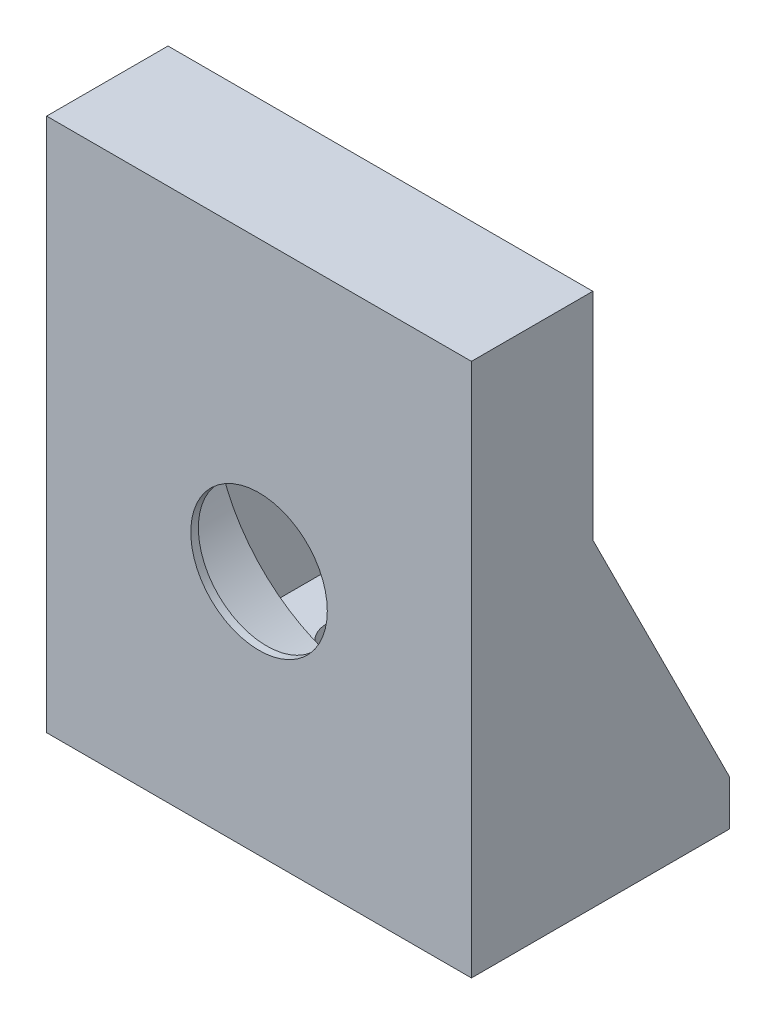
from build123d import *

# Parameters (mm, degrees)
SKETCH2_W           = 28
SKETCH2_H           = 35.2
SKETCH2_R           = 11
BOSS_EXTRUDE3_DEPTH = 8
SKETCH3_W           = 10
SKETCH3_H           = 3
BOSS_EXTRUDE4_DEPTH = 28
BOSS_EXTRUDE5_DEPTH = 3
BOSS_EXTRUDE6_START = -28
BOSS_EXTRUDE6_DEPTH = 3
SKETCH4_R           = 2
CUT_EXTRUDE1_DEPTH  = 101.089134132
SKETCH2_3_R         = 11
SKETCH2_3_R_2       = 4.5
BOSS_EXTRUDE7_DEPTH = 0.5


with BuildPart() as part:
    # Sketch2 → Boss-Extrude3 (new body)
    with BuildSketch(Plane.XY.offset(-2.538447986)):
        with Locations((-78.732107824, 19.43595021)):
            Rectangle(SKETCH2_W, SKETCH2_H)
        with Locations((-78.732107824, 18.03595021)):
            Circle(SKETCH2_R, mode=Mode.SUBTRACT)
    extrude(amount=-BOSS_EXTRUDE3_DEPTH)

    # Sketch3 → Boss-Extrude4 (add)
    with BuildSketch(Plane.ZY.offset(92.732107824)):
        with Locations((-14.538447986, 3.33595021)):
            Rectangle(SKETCH3_W, SKETCH3_H)
    extrude(amount=-BOSS_EXTRUDE4_DEPTH)

    # Sketch3<3> → Boss-Extrude5 (add)
    with BuildSketch(Plane.ZY.offset(92.732107824)):
        Polygon((-19.538447986, 4.83595021), (-9.538447986, 4.83595021), (-9.538447986, 24.83595021), align=None)
    extrude(amount=-BOSS_EXTRUDE5_DEPTH)

    # Sketch3<4> → Boss-Extrude6 (add)
    with BuildSketch(Plane.ZY.offset(92.732107824).offset(BOSS_EXTRUDE6_START)):
        Polygon((-19.538447986, 4.83595021), (-9.538447986, 4.83595021), (-9.538447986, 24.83595021), (-10.538447986, 22.83595021), align=None)
    extrude(amount=BOSS_EXTRUDE6_DEPTH)

    # Sketch4 → Cut-Extrude1 (cut, through all)
    with BuildSketch(Plane(origin=(0, 4.83595021, 0), x_dir=(1, 0, 0), z_dir=(0, 1, 0))):
        with Locations(Location((-72.732107824, 15.038447986, 0), (0, 0, 270))):
            Circle(SKETCH4_R)
        with Locations(Location((-84.732107824, 15.038447986, 0), (0, 0, 90))):
            Circle(SKETCH4_R)
    extrude(amount=-CUT_EXTRUDE1_DEPTH, mode=Mode.SUBTRACT)

    # Sketch2<3> → Boss-Extrude7 (add)
    with BuildSketch(Plane.XY.offset(-2.538447986)):
        with Locations((-78.732107824, 18.03595021)):
            Circle(SKETCH2_3_R)
        with Locations((-78.732107824, 18.03595021)):
            Circle(SKETCH2_3_R_2, mode=Mode.SUBTRACT)
    extrude(amount=-BOSS_EXTRUDE7_DEPTH)


solid = part.part
